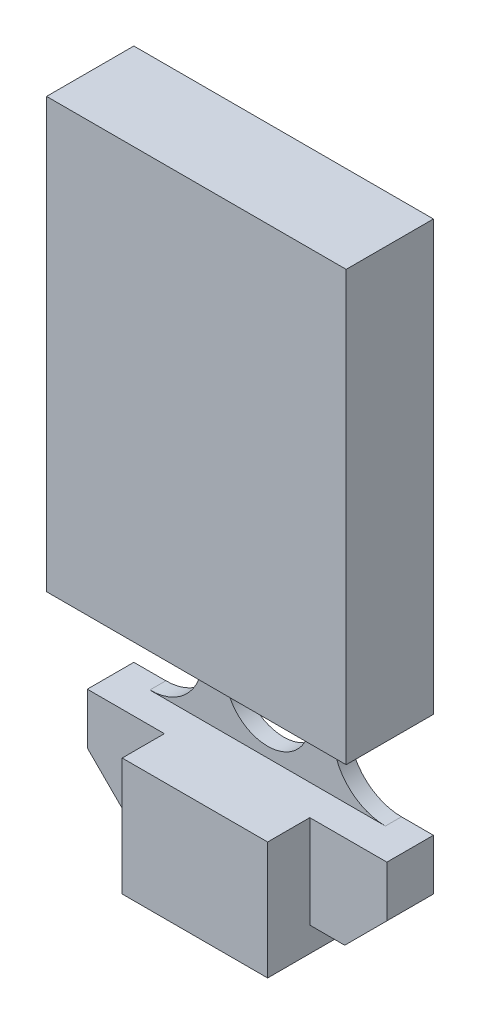
from build123d import *

# Parameters (mm, degrees)
SKETCH1_W           = 20.6
SKETCH1_H           = 43.1
BOSS_EXTRUDE1_DEPTH = 1.1
SKETCH2_W           = 20.6
SKETCH2_H           = 29.5
BOSS_EXTRUDE2_DEPTH = 4.9
SKETCH3_R           = 2.9
CUT_EXTRUDE1_DEPTH  = 4.9
SKETCH4_W           = 10
SKETCH4_H           = 8.1
BOSS_EXTRUDE3_DEPTH = 5
SKETCH5_W           = 20.6
SKETCH5_H           = 6.4
BOSS_EXTRUDE4_DEPTH = 2.1
CUT_EXTRUDE2_DEPTH  = 48.877029983


with BuildPart() as part:
    # Sketch1 → Boss-Extrude1 (new body)
    with BuildSketch(Plane.XY):
        with Locations((10.3, 21.55)):
            Rectangle(SKETCH1_W, SKETCH1_H)
    extrude(amount=BOSS_EXTRUDE1_DEPTH)

    # Sketch2 → Boss-Extrude2 (add)
    with BuildSketch(Plane.XY.offset(1.1)):
        with Locations((10.3, 28.35)):
            Rectangle(SKETCH2_W, SKETCH2_H)
    extrude(amount=BOSS_EXTRUDE2_DEPTH)

    # Sketch3 → Cut-Extrude1 (cut)
    with BuildSketch(Plane.XY.offset(1.1)):
        with Locations((10.3, 10)):
            Circle(SKETCH3_R)
        with BuildLine():
            Line((0, 13.6), (2.2, 13.6))
            ThreePointArc((2.2, 13.6), (5.8, 10), (2.2, 6.4))
            Line((2.2, 6.4), (0, 6.4))
            Line((0, 6.4), (0, 13.6))
        make_face()
        with BuildLine():
            Line((20.6, 13.6), (18.4, 13.6))
            ThreePointArc((18.4, 13.6), (14.8, 10), (18.4, 6.4))
            Line((18.4, 6.4), (20.6, 6.4))
            Line((20.6, 6.4), (20.6, 13.6))
        make_face()
    extrude(amount=-CUT_EXTRUDE1_DEPTH, mode=Mode.SUBTRACT)

    # Sketch4 → Boss-Extrude3 (add)
    with BuildSketch(Plane.XY.offset(1.1)):
        with Locations((10.3, 2.35)):
            Rectangle(SKETCH4_W, SKETCH4_H)
    extrude(amount=BOSS_EXTRUDE3_DEPTH)

    # Sketch5 → Boss-Extrude4 (add)
    with BuildSketch(Plane.XY.offset(1.1)):
        with Locations((10.3, 3.2)):
            Rectangle(SKETCH5_W, SKETCH5_H)
    extrude(amount=BOSS_EXTRUDE4_DEPTH)

    # Sketch6 → Cut-Extrude2 (cut, through all)
    with BuildSketch(Plane.XY.offset(3.2)):
        Polygon((0, 0), (0, 2.9), (2.9, 0), align=None)
        Polygon((20.6, 0), (20.6, 2.9), (17.7, 0), align=None)
    extrude(amount=-CUT_EXTRUDE2_DEPTH, mode=Mode.SUBTRACT)


solid = part.part
